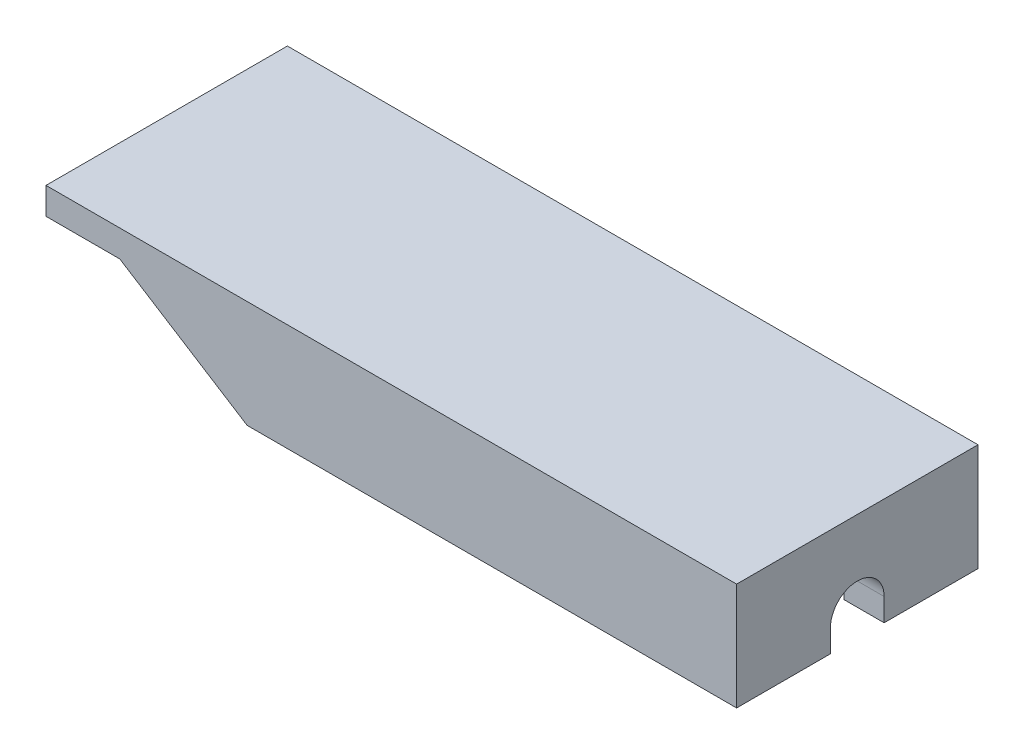
from build123d import *

# Parameters (mm, degrees)
EXTRUDE_1_DEPTH     = 9
CUT_EXTRUDE_1_DEPTH = 5
CUT_EXTRUDE_2_REACH = 54.889


with BuildPart() as part:
    # 草图1 → 凸台-拉伸1 (new, symmetric)
    with BuildSketch(Plane.XY):
        Polygon((0, 0), (51.5, 0), (51.5, -8), (15, -8), (5.5, -2), (0, -2), align=None)
    extrude(amount=EXTRUDE_1_DEPTH, both=True)

    # 草图2 → 切除-拉伸1 (cut)
    with BuildSketch(Plane.XZ.offset(8)):
        Polygon((15, -6), (48.5, -6), (48.5, 6), (15, 6), (5.5, 6), (3, 6), (3, -6), (5.5, -6), align=None)
    extrude(amount=-CUT_EXTRUDE_1_DEPTH, mode=Mode.SUBTRACT)

    # 草图3 → 切除-拉伸2 (cut, up to next)
    with BuildSketch(Plane(origin=(51.5, 0, 0), x_dir=(0, 0, -1), z_dir=(1, 0, 0)), mode=Mode.PRIVATE) as cut_extrude_2_sk1:
        with BuildLine():
            Line((2, -6.3), (2, -8))
            Line((2, -8), (-2, -8))
            Line((-2, -8), (-2, -6.3))
            ThreePointArc((-2, -6.3), (0, -4.3), (2, -6.3))
        make_face()
    cut_extrude_2_tool1 = extrude(cut_extrude_2_sk1.sketch, amount=-CUT_EXTRUDE_2_REACH, mode=Mode.PRIVATE) & part.part
    add(cut_extrude_2_tool1.solids().sort_by_distance((51.5, -6.334141, 0))[0], mode=Mode.SUBTRACT)


solid = part.part
